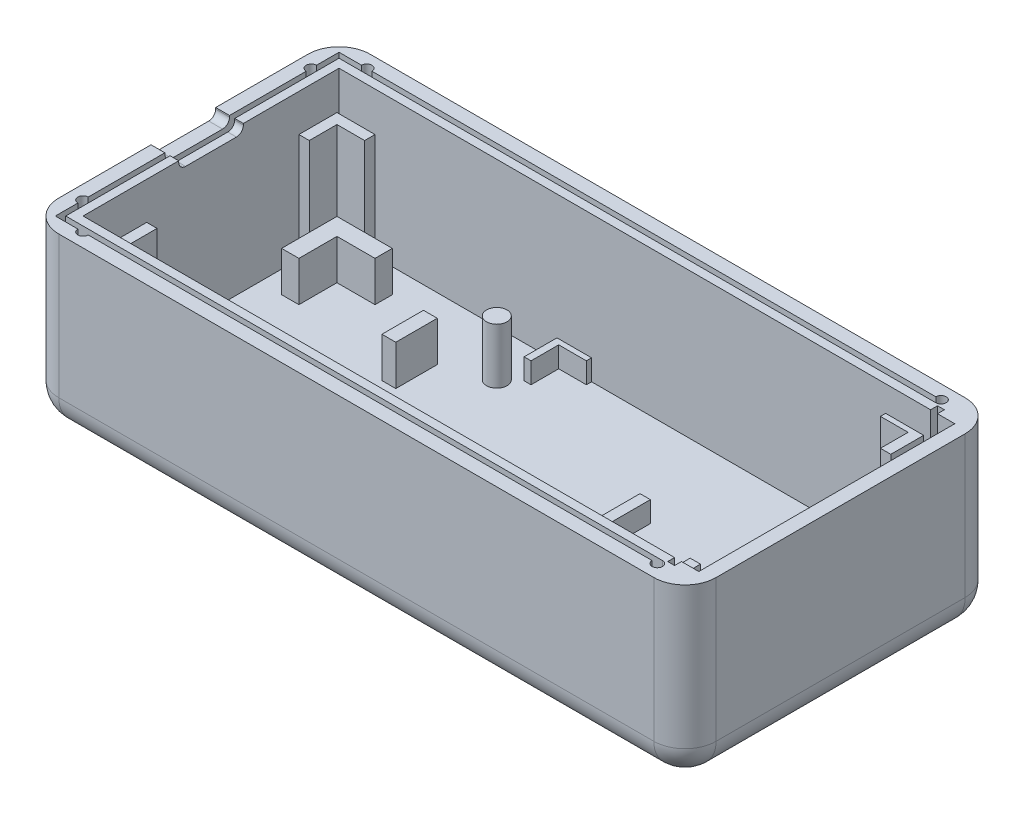
from build123d import *

# Parameters (mm, degrees)
SKETCH_1_W           = 95
SKETCH_1_H           = 45
EXTRUDE_1_DEPTH      = 25
SHELL_1_T            = -4
FILLET_1_R           = 4.5
SKETCH_2_R           = 0.75
CUT_EXTRUDE_1_DEPTH  = 5
CUT_EXTRUDE_3_DEPTH  = 2.5
SKETCH_8_W           = 34
SKETCH_8_H           = 10
CUT_EXTRUDE_4_DEPTH  = 3
SKETCH_9_W           = 37
SKETCH_9_H           = 21
CUT_EXTRUDE_7_DEPTH  = 2
SKETCH_7_W           = 1
SKETCH_7_H           = 37
CUT_EXTRUDE_8_DEPTH  = 1
SKETCH_11_W          = 1
SKETCH_11_H          = 21
CUT_EXTRUDE_10_DEPTH = 1
SKETCH_12_W          = 1
SKETCH_12_H          = 21
CUT_EXTRUDE_11_DEPTH = 1
SKETCH_15_W          = 0.5
SKETCH_15_H          = 10
EXTRUDE_2_DEPTH      = 1
SKETCH_17_W          = 1.5
SKETCH_17_H          = 10
EXTRUDE_3_DEPTH      = 3
SKETCH_18_R          = 1.485
EXTRUDE_4_DEPTH      = 8
SKETCH_19_W          = 9.34
SKETCH_19_H          = 1.2
CUT_EXTRUDE_12_DEPTH = 10
FILLET_2_R           = 1
FILLET_3_R           = 1
FILLET_4_R           = 1
FILLET_5_R           = 1
SKETCH_20_W          = 2
SKETCH_20_H          = 6
EXTRUDE_5_DEPTH      = 5.8
EXTRUDE_6_DEPTH      = 17.3
EXTRUDE_7_DEPTH      = 14.3
SKETCH_26_W          = 15
SKETCH_26_H          = 4.9
EXTRUDE_8_DEPTH      = 2.4
SKETCH_27_W          = 12
SKETCH_27_H          = 4.4
SKETCH_27_H_2        = 4.5
EXTRUDE_9_DEPTH      = 4.6


with BuildPart() as part:
    # Эскиз1 → Бобышка-Вытянуть1 (new body)
    with BuildSketch(Plane(origin=(0, 0, 0), x_dir=(1, 0, 0), z_dir=(0, 1, 0))):
        with Locations((47.5, -22.5)):
            Rectangle(SKETCH_1_W, SKETCH_1_H)
    extrude(amount=EXTRUDE_1_DEPTH)

    # Оболочка1
    shell_1_openings = [part.faces().sort_by_distance(p)[0] for p in [
        (47.5, 25, 22.5),
    ]]
    offset(amount=SHELL_1_T, openings=shell_1_openings, kind=Kind.INTERSECTION)

    # Скругление1
    fillet_1_edges = [part.edges().sort_by_distance(p)[0] for p in [
        (47.5, 0, 0),
        (95, 0, 22.5),
        (47.5, 0, 45),
        (0, 0, 22.5),
        (0, 12.5, 0),
        (95, 12.5, 0),
        (95, 12.5, 45),
        (0, 12.5, 45),
    ]]
    fillet(fillet_1_edges, radius=FILLET_1_R)

    # Эскиз2 → Вырез-Вытянуть1 (cut)
    with BuildSketch(Plane(origin=(0, 25, 0), x_dir=(1, 0, 0), z_dir=(0, 1, 0))):
        with Locations((6, -2)):
            Circle(SKETCH_2_R)
        with BuildLine():
            ThreePointArc((2, -5.25), (2.530330086, -5.469669914), (2.75, -6))
            Line((2.75, -6), (2.75, -2.75))
            Line((2.75, -2.75), (6, -2.75))
            ThreePointArc((6, -2.75), (5.469669914, -2.530330086), (5.25, -2))
            Line((5.25, -2), (2, -2))
            Line((2, -2), (2, -5.25))
        make_face()
        with Locations((2, -6)):
            Circle(SKETCH_2_R)
        with Locations(Location((89, -43, 0), (0, 0, 270))):
            Circle(SKETCH_2_R)
        with Locations(Location((89, -2, 0), (0, 0, 270))):
            Circle(SKETCH_2_R)
        with Locations((2, -39)):
            Circle(SKETCH_2_R)
        with BuildLine():
            Line((2.75, -42.25), (2.75, -39))
            ThreePointArc((2.75, -39), (2.530330086, -39.530330086), (2, -39.75))
            Line((2, -39.75), (2, -43))
            Line((2, -43), (5.25, -43))
            ThreePointArc((5.25, -43), (5.469669914, -42.469669914), (6, -42.25))
            Line((6, -42.25), (2.75, -42.25))
        make_face()
        with Locations((6, -43)):
            Circle(SKETCH_2_R)
    extrude(amount=-CUT_EXTRUDE_1_DEPTH, mode=Mode.SUBTRACT)

    # Эскиз2<6> → Вырез-Вытянуть3 (cut)
    with BuildSketch(Plane(origin=(0, 25, 0), x_dir=(1, 0, 0), z_dir=(0, 1, 0))):
        with BuildLine():
            Line((2.75, -39), (2.75, -6))
            ThreePointArc((2.75, -6), (2.530330086, -6.530330086), (2, -6.75))
            Line((2, -6.75), (2, -38.25))
            ThreePointArc((2, -38.25), (2.530330086, -38.469669914), (2.75, -39))
        make_face()
        with BuildLine():
            ThreePointArc((6.75, -2), (6.530330086, -2.530330086), (6, -2.75))
            Line((6, -2.75), (89, -2.75))
            ThreePointArc((89, -2.75), (88.469669914, -2.530330086), (88.25, -2))
            Line((88.25, -2), (6.75, -2))
        make_face()
        with BuildLine():
            Line((89, -42.25), (6, -42.25))
            ThreePointArc((6, -42.25), (6.530330086, -42.469669914), (6.75, -43))
            Line((6.75, -43), (88.25, -43))
            ThreePointArc((88.25, -43), (88.469669914, -42.469669914), (89, -42.25))
        make_face()
    extrude(amount=-CUT_EXTRUDE_3_DEPTH, mode=Mode.SUBTRACT)

    # Эскиз8 → Вырез-Вытянуть4 (cut)
    with BuildSketch(Plane.ZY.offset(-91)):
        with Locations((22.5, 14.5)):
            Rectangle(SKETCH_8_W, SKETCH_8_H)
    extrude(amount=-CUT_EXTRUDE_4_DEPTH, mode=Mode.SUBTRACT)

    # Эскиз9 → Вырез-Вытянуть7 (cut)
    with BuildSketch(Plane.ZY.offset(-91)):
        with Locations((22.5, 14.5)):
            Rectangle(SKETCH_9_W, SKETCH_9_H)
    extrude(amount=-CUT_EXTRUDE_7_DEPTH, mode=Mode.SUBTRACT)

    # Эскиз7 → Вырез-Вытянуть8 (cut)
    with BuildSketch(Plane(origin=(0, 4, 0), x_dir=(1, 0, 0), z_dir=(0, 1, 0))):
        with Locations((90, -22.5)):
            Rectangle(SKETCH_7_W, SKETCH_7_H)
    extrude(amount=-CUT_EXTRUDE_8_DEPTH, mode=Mode.SUBTRACT)

    # Эскиз11 → Вырез-Вытянуть10 (cut)
    with BuildSketch(Plane.XY.offset(4)):
        with Locations((90, 14.5)):
            Rectangle(SKETCH_11_W, SKETCH_11_H)
    extrude(amount=-CUT_EXTRUDE_10_DEPTH, mode=Mode.SUBTRACT)

    # Эскиз12 → Вырез-Вытянуть11 (cut)
    with BuildSketch(Plane(origin=(0, 0, 41), x_dir=(-1, 0, 0), z_dir=(0, 0, -1))):
        with Locations((-90, 14.5)):
            Rectangle(SKETCH_12_W, SKETCH_12_H)
    extrude(amount=-CUT_EXTRUDE_11_DEPTH, mode=Mode.SUBTRACT)

    # Эскиз15 → Бобышка-Вытянуть2 (add)
    with BuildSketch(Plane.ZY.offset(-94)):
        with Locations((14.5, 14.5)):
            Rectangle(SKETCH_15_W, SKETCH_15_H)
        with Locations((22.5, 14.5)):
            Rectangle(SKETCH_15_W, SKETCH_15_H)
        with Locations((30.5, 14.5)):
            Rectangle(SKETCH_15_W, SKETCH_15_H)
    extrude(amount=EXTRUDE_2_DEPTH)

    # Эскиз17 → Бобышка-Вытянуть3 (add)
    with BuildSketch(Plane(origin=(0, 4, 0), x_dir=(1, 0, 0), z_dir=(0, 1, 0))):
        with Locations((61.75, -22.5)):
            Rectangle(SKETCH_17_W, SKETCH_17_H)
        Polygon((83, -3.75), (83, -4.75), (87, -4.75), (87, -8.75), (88.5, -8.75), (88.5, -3.75), align=None)
        Polygon((40.5, -3.75), (35.5, -3.75), (35.5, -8.75), (36.5, -8.75), (36.5, -4.75), (40.5, -4.75), align=None)
        Polygon((87, -36.25), (88.5, -36.25), (88.5, -41.25), (83, -41.25), (83, -40.25), (87, -40.25), align=None)
        Polygon((40.5, -40.25), (40.5, -41.25), (35.5, -41.25), (35.5, -36.25), (36.5, -36.25), (36.5, -40.25), align=None)
    extrude(amount=EXTRUDE_3_DEPTH)

    # Эскиз18 → Бобышка-Вытянуть4 (add)
    with BuildSketch(Plane(origin=(0, 4, 0), x_dir=(1, 0, 0), z_dir=(0, 1, 0))):
        with Locations(Location((33.4, -10.6, 0), (0, 0, 270))):
            Circle(SKETCH_18_R)
        with Locations(Location((33.4, -34.4, 0), (0, 0, 90))):
            Circle(SKETCH_18_R)
    extrude(amount=EXTRUDE_4_DEPTH)

    # Эскиз19 → Вырез-Вытянуть12 (cut)
    with BuildSketch(Plane.ZY):
        with Locations((22.5, 24.4)):
            Rectangle(SKETCH_19_W, SKETCH_19_H)
    extrude(amount=-CUT_EXTRUDE_12_DEPTH, mode=Mode.SUBTRACT)

    # Скругление2
    fillet_2_edges = [part.edges().sort_by_distance(p)[0] for p in [
        (1, 23.8, 27.17),
    ]]
    fillet(fillet_2_edges, radius=FILLET_2_R)

    # Скругление3
    fillet_3_edges = [part.edges().sort_by_distance(p)[0] for p in [
        (3.375, 23.8, 27.17),
    ]]
    fillet(fillet_3_edges, radius=FILLET_3_R)

    # Скругление4
    fillet_4_edges = [part.edges().sort_by_distance(p)[0] for p in [
        (3.375, 23.8, 17.83),
    ]]
    fillet(fillet_4_edges, radius=FILLET_4_R)

    # Скругление5
    fillet_5_edges = [part.edges().sort_by_distance(p)[0] for p in [
        (1, 23.8, 17.83),
    ]]
    fillet(fillet_5_edges, radius=FILLET_5_R)

    # Эскиз20 → Бобышка-Вытянуть5 (add)
    with BuildSketch(Plane(origin=(0, 4, 0), x_dir=(1, 0, 0), z_dir=(0, 1, 0))):
        Polygon((15.2, -10), (9.7, -10), (9.7, -15.5), (7.2, -15.5), (7.2, -7.5), (15.2, -7.5), align=None)
        Polygon((9.7, -29.5), (9.7, -35), (15.2, -35), (15.2, -37.5), (7.2, -37.5), (7.2, -29.5), align=None)
        with Locations((26.2, -16)):
            Rectangle(SKETCH_20_W, SKETCH_20_H)
        with Locations((26.2, -29)):
            Rectangle(SKETCH_20_W, SKETCH_20_H)
    extrude(amount=EXTRUDE_5_DEPTH)

    # Эскиз22 → Бобышка-Вытянуть6 (add)
    with BuildSketch(Plane(origin=(0, 4, 0), x_dir=(1, 0, 0), z_dir=(0, 1, 0))):
        Polygon((7.2, -7.5), (7.2, -11.5), (5.7, -11.5), (5.7, -6), (11.2, -6), (11.2, -7.5), align=None)
        Polygon((7.2, -33.5), (5.7, -33.5), (5.7, -39), (11.2, -39), (11.2, -37.5), (7.2, -37.5), align=None)
    extrude(amount=EXTRUDE_6_DEPTH)

    # Эскиз25 → Бобышка-Вытянуть7 (add)
    with BuildSketch(Plane(origin=(0, 7, 0), x_dir=(1, 0, 0), z_dir=(0, 1, 0))):
        Polygon((83, -4), (83, -4.75), (87, -4.75), (87, -8.75), (88.5, -8.75), (88.5, -4), align=None)
        Polygon((83, -40.25), (83, -41), (88.5, -41), (88.5, -36.25), (87, -36.25), (87, -40.25), align=None)
    extrude(amount=EXTRUDE_7_DEPTH)

    # Эскиз26 → Бобышка-Вытянуть8 (add)
    with BuildSketch(Plane.XZ):
        with Locations((41.5, 22.5)):
            Rectangle(SKETCH_26_W, SKETCH_26_H)
    extrude(amount=EXTRUDE_8_DEPTH)

    # Эскиз27 → Бобышка-Вытянуть9 (add)
    with BuildSketch(Plane.XZ):
        with Locations((55, 28.6)):
            Rectangle(SKETCH_27_W, SKETCH_27_H)
        with Locations((55, 16.45)):
            Rectangle(SKETCH_27_W, SKETCH_27_H_2)
    extrude(amount=EXTRUDE_9_DEPTH)


solid = part.part
